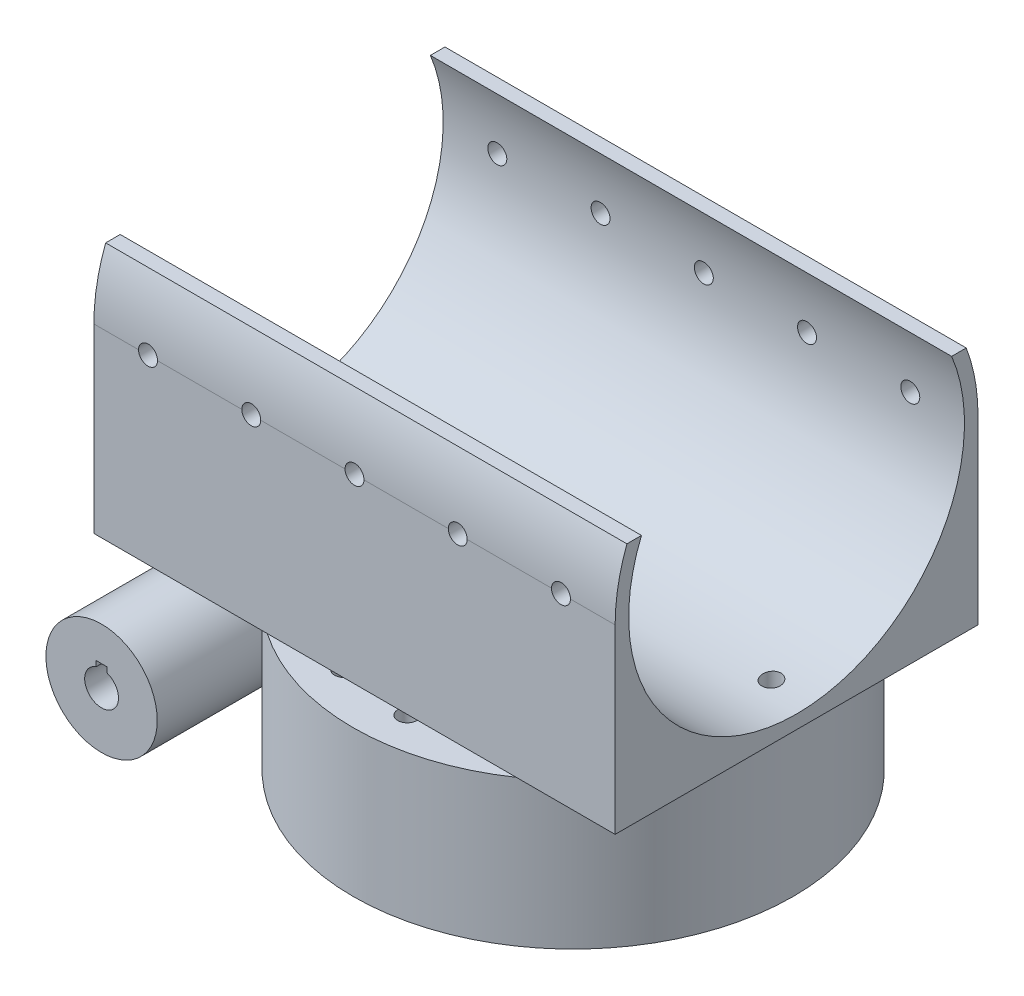
from build123d import *

# Parameters (mm, degrees)
SKETCH1_R               = 162.5
BOSS_EXTRUDE1_DEPTH     = 108
SKETCH2_R               = 72.5
CUT_EXTRUDE1_DEPTH      = 108
SKETCH3_R               = 112
CUT_EXTRUDE2_DEPTH      = 29
CUT_EXTRUDE4_DEPTH      = 254.922232189
CUT_EXTRUDE4_DEPTH_BACK = 254.922232189
SKETCH5_R               = 7
SKETCH6_R               = 41.125
BOSS_EXTRUDE2_DEPTH     = 322
BOSS_EXTRUDE6_DEPTH     = 385
SKETCH7_R               = 12.5
CUT_EXTRUDE5_DEPTH      = 66
CUT_EXTRUDE6_DEPTH      = 66
CUT_EXTRUDE7_START      = -385
SKETCH15_R              = 7
CUT_EXTRUDE7_DEPTH      = 385
CUT_EXTRUDE8_DEPTH      = 477.620050631
CUT_EXTRUDE8_DEPTH_BACK = 477.620050631
SKETCH16_R              = 7


with BuildPart() as part:
    # Sketch1 → Boss-Extrude1 (new body)
    with BuildSketch(Plane(origin=(0, 0, 0), x_dir=(1, 0, 0), z_dir=(0, 1, 0))):
        with Locations(Location((0, 0, 0), (0, 0, 270))):
            Circle(SKETCH1_R)
    extrude(amount=BOSS_EXTRUDE1_DEPTH)

    # Sketch2 → Cut-Extrude1 (cut)
    with BuildSketch(Plane(origin=(0, 108, 0), x_dir=(1, 0, 0), z_dir=(0, 1, 0))):
        with Locations(Location((0, 0, 0), (0, 0, 270))):
            Circle(SKETCH2_R)
    extrude(amount=-CUT_EXTRUDE1_DEPTH, mode=Mode.SUBTRACT)

    # Sketch3 → Cut-Extrude2 (cut)
    with BuildSketch(Plane(origin=(0, 108, 0), x_dir=(1, 0, 0), z_dir=(0, 1, 0))):
        with Locations(Location((0, 0, 0), (0, 0, 270))):
            Circle(SKETCH3_R)
    extrude(amount=-CUT_EXTRUDE2_DEPTH, mode=Mode.SUBTRACT)

    # Sketch5 → Cut-Extrude4 (cut, two sides: drawn at the far end of the back side and taken through both)
    with BuildSketch(Plane(origin=(0, 108, 0), x_dir=(1, 0, 0), z_dir=(0, 1, 0)).offset(-CUT_EXTRUDE4_DEPTH_BACK)):
        with Locations(Location((-103.546468267, 86.620603262, 0), (0, 0, 270))):
            Circle(SKETCH5_R)
        with Locations(Location((-62.516192926, 119.652520333, 0), (0, 0, 270))):
            Circle(SKETCH5_R)
        with Locations(Location((-11.968393923, 134.468425836, 0), (0, 0, 270))):
            Circle(SKETCH5_R)
        with Locations(Location((40.401484562, 128.812732465, 0), (0, 0, 270))):
            Circle(SKETCH5_R)
        with Locations(Location((86.620603262, 103.546468267, 0), (0, 0, 270))):
            Circle(SKETCH5_R)
        with Locations(Location((119.652520333, 62.516192926, 0), (0, 0, 270))):
            Circle(SKETCH5_R)
        with Locations(Location((134.468425836, 11.968393923, 0), (0, 0, 270))):
            Circle(SKETCH5_R)
        with Locations(Location((128.812732465, -40.401484562, 0), (0, 0, 270))):
            Circle(SKETCH5_R)
        with Locations(Location((103.546468267, -86.620603262, 0), (0, 0, 270))):
            Circle(SKETCH5_R)
        with Locations(Location((62.516192926, -119.652520333, 0), (0, 0, 270))):
            Circle(SKETCH5_R)
        with Locations(Location((11.968393923, -134.468425836, 0), (0, 0, 270))):
            Circle(SKETCH5_R)
        with Locations(Location((-40.401484562, -128.812732465, 0), (0, 0, 270))):
            Circle(SKETCH5_R)
        with Locations(Location((-86.620603262, -103.546468267, 0), (0, 0, 270))):
            Circle(SKETCH5_R)
        with Locations(Location((-119.652520333, -62.516192926, 0), (0, 0, 270))):
            Circle(SKETCH5_R)
        with Locations(Location((-134.468425836, -11.968393923, 0), (0, 0, 270))):
            Circle(SKETCH5_R)
        with Locations(Location((-128.812732465, 40.401484562, 0), (0, 0, 270))):
            Circle(SKETCH5_R)
    extrude(amount=CUT_EXTRUDE4_DEPTH + CUT_EXTRUDE4_DEPTH_BACK, mode=Mode.SUBTRACT)

    # Sketch6 → Boss-Extrude2 (add)
    with BuildSketch(Plane.XY.offset(174.15)):
        with Locations((-174.15, 51.9)):
            Circle(SKETCH6_R)
    extrude(amount=-BOSS_EXTRUDE2_DEPTH)

    # Sketch14 → Boss-Extrude6 (add)
    with BuildSketch(Plane(origin=(-220, 0, 0), x_dir=(0, 0, -1), z_dir=(1, 0, 0))):
        with BuildLine():
            Line((134, 108), (134, 242))
            ThreePointArc((134, 242), (131.806711125, 266.145204541), (125.298643249, 289.5))
            Line((125.298643249, 289.5), (114.541477204, 289.5))
            ThreePointArc((114.541477204, 289.5), (0, 118), (-114.541477204, 289.5))
            Line((-114.541477204, 289.5), (-125.298643249, 289.5))
            ThreePointArc((-125.298643249, 289.5), (-131.806711125, 266.145204541), (-134, 242))
            Line((-134, 242), (-134, 108))
            Line((-134, 108), (134, 108))
        make_face()
    extrude(amount=BOSS_EXTRUDE6_DEPTH)

    # Sketch7 → Cut-Extrude5 (cut)
    with BuildSketch(Plane.XY.offset(174.15)):
        with Locations((-174.15, 51.9)):
            Circle(SKETCH7_R)
    extrude(amount=-CUT_EXTRUDE5_DEPTH, mode=Mode.SUBTRACT)

    # Sketch8 → Cut-Extrude6 (cut)
    with BuildSketch(Plane.XY.offset(174.15)):
        with BuildLine():
            Line((-178.15, 67.7), (-178.15, 63.742719282))
            ThreePointArc((-178.15, 63.742719282), (-174.15, 64.4), (-170.15, 63.742719282))
            Line((-170.15, 63.742719282), (-170.15, 67.7))
            Line((-170.15, 67.7), (-178.15, 67.7))
        make_face()
    extrude(amount=-CUT_EXTRUDE6_DEPTH, mode=Mode.SUBTRACT)

    # Sketch15 → Cut-Extrude7 (cut)
    with BuildSketch(Plane.XZ.offset(CUT_EXTRUDE7_START)):
        with Locations(Location((-134.468425836, 11.968393923, 0), (0, 0, 90))):
            Circle(SKETCH15_R)
        with Locations(Location((134.468425836, -11.968393923, 0), (0, 0, 90))):
            Circle(SKETCH15_R)
    extrude(amount=CUT_EXTRUDE7_DEPTH, mode=Mode.SUBTRACT)

    # Sketch16 → Cut-Extrude8 (cut, two sides: drawn at the far end of the back side and taken through both)
    with BuildSketch(Plane(origin=(0, 0, -134), x_dir=(-1, 0, 0), z_dir=(0, 0, -1)).offset(-CUT_EXTRUDE8_DEPTH_BACK)):
        with Locations(Location((-125, 242, 0), (0, 0, 90))):
            Circle(SKETCH16_R)
        with Locations(Location((-48.75, 242, 0), (0, 0, 90))):
            Circle(SKETCH16_R)
        with Locations(Location((27.5, 242, 0), (0, 0, 90))):
            Circle(SKETCH16_R)
        with Locations(Location((103.75, 242, 0), (0, 0, 90))):
            Circle(SKETCH16_R)
        with Locations(Location((180, 242, 0), (0, 0, 90))):
            Circle(SKETCH16_R)
    extrude(amount=CUT_EXTRUDE8_DEPTH + CUT_EXTRUDE8_DEPTH_BACK, mode=Mode.SUBTRACT)


solid = part.part
